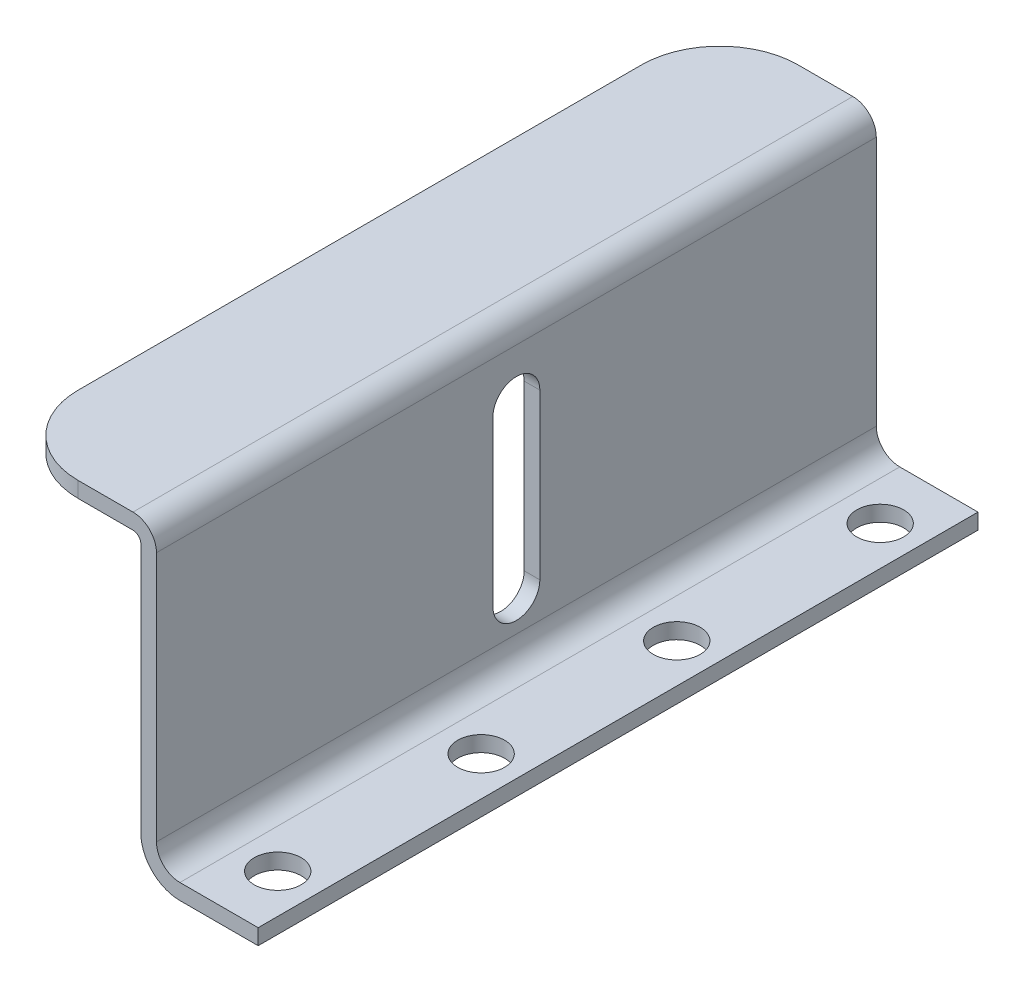
from build123d import *

# Parameters (mm, degrees)
EXTRUDE_1_DEPTH     = 46
SKETCH_2_R          = 3
CUT_EXTRUDE_1_DEPTH = 10
CUT_EXTRUDE_2_DEPTH = 10
FILLET_1_R          = 10


with BuildPart() as part:
    # 草图1 → 拉伸-薄壁1 (new, symmetric)
    with BuildSketch(Plane.XY):
        with BuildLine():
            Line((-15.684450605, 22.852628588), (1.315549395, 22.852628588))
            ThreePointArc((1.315549395, 22.852628588), (3.436869738, 21.973948932), (4.315549395, 19.852628588))
            Line((4.315549395, 19.852628588), (4.315549395, -12.147371412))
            ThreePointArc((4.315549395, -12.147371412), (5.194229051, -14.268691755), (7.315549395, -15.147371412))
            Line((7.315549395, -15.147371412), (17.315549395, -15.147371412))
            Line((17.315549395, -15.147371412), (17.315549395, -17.147371412))
            Line((17.315549395, -17.147371412), (7.315549395, -17.147371412))
            ThreePointArc((7.315549395, -17.147371412), (3.780015489, -15.682905318), (2.315549395, -12.147371412))
            Line((2.315549395, -12.147371412), (2.315549395, 19.852628588))
            ThreePointArc((2.315549395, 19.852628588), (2.022656176, 20.55973537), (1.315549395, 20.852628588))
            Line((1.315549395, 20.852628588), (-15.684450605, 20.852628588))
            Line((-15.684450605, 20.852628588), (-15.684450605, 22.852628588))
        make_face()
    extrude(amount=EXTRUDE_1_DEPTH, both=True)

    # 草图2 → 切除-拉伸1 (cut)
    with BuildSketch(Plane(origin=(0, -15.147371412, 0), x_dir=(1, 0, 0), z_dir=(0, 1, 0))):
        with Locations(Location((12.315549395, -38.5, 0), (0, 0, 270))):
            Circle(SKETCH_2_R)
        with Locations(Location((12.315549395, -12.5, 0), (0, 0, 270))):
            Circle(SKETCH_2_R)
        with Locations(Location((12.315549395, 12.5, 0), (0, 0, 270))):
            Circle(SKETCH_2_R)
        with Locations(Location((12.315549395, 38.5, 0), (0, 0, 270))):
            Circle(SKETCH_2_R)
    extrude(amount=-CUT_EXTRUDE_1_DEPTH, mode=Mode.SUBTRACT)

    # 草图3 → 切除-拉伸2 (cut)
    with BuildSketch(Plane(origin=(4.315549395, 0, 0), x_dir=(0, 0, -1), z_dir=(1, 0, 0))):
        with BuildLine():
            Line((-3, -7.647371412), (-3, 13.352628588))
            ThreePointArc((-3, 13.352628588), (0, 16.352628588), (3, 13.352628588))
            Line((3, 13.352628588), (3, -7.647371412))
            ThreePointArc((3, -7.647371412), (0, -10.647371412), (-3, -7.647371412))
        make_face()
    extrude(amount=-CUT_EXTRUDE_2_DEPTH, mode=Mode.SUBTRACT)

    # 圆角1
    fillet_1_edges = [part.edges().sort_by_distance(p)[0] for p in [
        (-15.684450605, 21.852628588, -46),
        (-15.684450605, 21.852628588, 46),
    ]]
    fillet(fillet_1_edges, radius=FILLET_1_R)


solid = part.part
